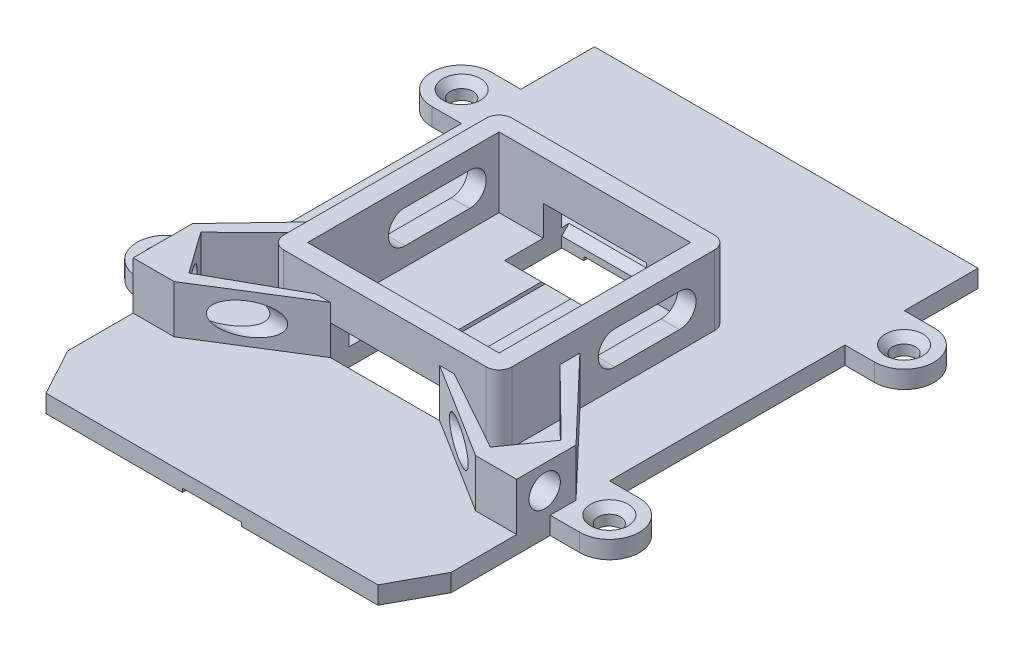
from build123d import *

# Parameters (mm, degrees)
SKETCH1_R              = 1.55
EXTRUDE_707_DEPTH      = 2.4
SKETCH2_W              = 31
SKETCH2_H              = 31
SKETCH2_W_2            = 26
SKETCH2_H_2            = 26
GPS_DEPTH              = 9.5
GPS_2_R                = 1.75
CHAMFER_1832_SIZE      = 1
EXTRUDE_3171_DEPTH     = 6.5
SKETCH4_R              = 2.125
CUT_EXTRUDE_3634_DEPTH = 73.664551053
CUT_EXTRUDE_3926_DEPTH = 65.212061635
SKETCH7_W              = 14
SKETCH7_H              = 6.75
SKETCH7_W_2            = 14.827228548
CUT_EXTRUDE_4854_DEPTH = 6.5
SKETCH8_W              = 4
SKETCH8_H              = 17.5
CUT_EXTRUDE_5206_DEPTH = 0.5
CHAMFER_5287_SIZE      = 1
SKETCH9_W              = 8
SKETCH9_H              = 77.991423638
CUT_EXTRUDE_6206_DEPTH = 0.5


with BuildPart() as part:
    # Sketch1 → Extrude 707 (new body)
    with BuildSketch(Plane(origin=(0, 0, 0), x_dir=(1, 0, 0), z_dir=(0, 1, 0))):
        with BuildLine():
            Line((-26.041067799, 38.995711819), (26.041067799, 38.995711819))
            Line((26.041067799, 38.995711819), (26.041067799, 28.995711819))
            Line((26.041067799, 28.995711819), (30.074330581, 28.995711819))
            ThreePointArc((30.074330581, 28.995711819), (34.107558501, 24.94567978), (30.040792356, 20.929325701))
            Line((30.040792356, 20.929325701), (26.041067799, 20.929325701))
            Line((26.041067799, 20.929325701), (26.041067799, -11.037902063))
            Line((26.041067799, -11.037902063), (30.074330581, -11.037902063))
            ThreePointArc((30.074330581, -11.037902063), (34.107558501, -15.087934101), (30.040792356, -19.104288181))
            Line((30.040792356, -19.104288181), (26.041067799, -19.104288181))
            Line((26.041067799, -19.104288181), (26.041067799, -32.550614881))
            Line((26.041067799, -32.550614881), (22.539090807, -38.995711819))
            Line((22.539090807, -38.995711819), (-22.539090807, -38.995711819))
            Line((-22.539090807, -38.995711819), (-26.041067799, -32.550614881))
            Line((-26.041067799, -32.550614881), (-26.041067799, -19.104288181))
            Line((-26.041067799, -19.104288181), (-30.040792356, -19.104288181))
            ThreePointArc((-30.040792356, -19.104288181), (-34.107558501, -15.087934101), (-30.074330581, -11.037902063))
            Line((-30.074330581, -11.037902063), (-26.041067799, -11.037902063))
            Line((-26.041067799, -11.037902063), (-26.041067799, 20.929325701))
            Line((-26.041067799, 20.929325701), (-30.040792356, 20.929325701))
            ThreePointArc((-30.040792356, 20.929325701), (-34.107558501, 24.94567978), (-30.074330581, 28.995711819))
            Line((-30.074330581, 28.995711819), (-26.041067799, 28.995711819))
            Line((-26.041067799, 28.995711819), (-26.041067799, 38.995711819))
        make_face()
        with Locations(Location((-30.041067799, 24.962449038, 0), (0, 0, 270))):
            Circle(SKETCH1_R, mode=Mode.SUBTRACT)
        with Locations(Location((30.041067799, 24.962449038, 0), (0, 0, 90))):
            Circle(SKETCH1_R, mode=Mode.SUBTRACT)
        with Locations(Location((-30.041067799, -15.071164844, 0), (0, 0, 270))):
            Circle(SKETCH1_R, mode=Mode.SUBTRACT)
        with Locations(Location((30.041067799, -15.071164844, 0), (0, 0, 90))):
            Circle(SKETCH1_R, mode=Mode.SUBTRACT)
    extrude(amount=EXTRUDE_707_DEPTH)

    # Sketch2 → GPS (add)
    with BuildSketch(Plane(origin=(0, 2.4, 0), x_dir=(1, 0, 0), z_dir=(0, 1, 0))):
        Rectangle(SKETCH2_W, SKETCH2_H)
        Rectangle(SKETCH2_W_2, SKETCH2_H_2, mode=Mode.SUBTRACT)
    extrude(amount=GPS_DEPTH)

    # GPS 2
    gps_2_edges = [part.edges().sort_by_distance(p)[0] for p in [
        (15.5, 7.15, -15.5),
        (-15.5, 7.15, -15.5),
        (-15.5, 7.15, 15.5),
        (15.5, 7.15, 15.5),
    ]]
    fillet(gps_2_edges, radius=GPS_2_R)

    # Chamfer 1832
    chamfer_1832_edges = [part.edges().sort_by_distance(p)[0] for p in [
        (-30.041067799, 2.4, -26.512449038),
        (30.041067799, 2.4, -23.412449038),
        (30.041067799, 2.4, 16.621164844),
        (-30.041067799, 2.4, 13.521164844),
    ]]
    chamfer(chamfer_1832_edges, length=CHAMFER_1832_SIZE)

    # Sketch3 → Extrude 3171 (add)
    with BuildSketch(Plane(origin=(0, 2.4, 0), x_dir=(1, 0, 0), z_dir=(0, 1, 0))):
        Polygon((-24.467823985, -16.04483058), (-15.5, -7.229070577), (-15.5, -4.529331749), (-26.041067799, -15.596764458), (-26.041067799, -23.659714375), (-20.467823985, -23.659714375), (-7.413614274, -15.5), (-9.413614274, -15.5), (-20.467823985, -21.659714375), align=None)
        Polygon((9.413614274, -15.5), (7.413614274, -15.5), (20.467823985, -23.659714375), (26.041067799, -23.659714375), (26.041067799, -15.596764458), (15.5, -4.529331749), (15.5, -7.229070577), (24.467823985, -16.04483058), (20.467823985, -21.659714375), align=None)
    extrude(amount=EXTRUDE_3171_DEPTH)

    # Sketch4 → Cut-Extrude 3634 (cut, through all)
    with BuildSketch(Plane.ZY.offset(26.041067799)):
        with Locations((19.852272478, 5.65)):
            Circle(SKETCH4_R)
    extrude(amount=-CUT_EXTRUDE_3634_DEPTH, mode=Mode.SUBTRACT)

    # Sketch6 → Cut-Extrude 3926 (cut, through all)
    with BuildSketch(Plane.ZY.offset(15.5)):
        with BuildLine():
            Line((-9, 9.4), (-0.220668251, 9.4))
            ThreePointArc((-0.220668251, 9.4), (2.029331749, 7.15), (-0.220668251, 4.9))
            Line((-0.220668251, 4.9), (-9, 4.9))
            ThreePointArc((-9, 4.9), (-11.25, 7.15), (-9, 9.4))
        make_face()
    extrude(amount=-CUT_EXTRUDE_3926_DEPTH, mode=Mode.SUBTRACT)

    # Sketch7 → Cut-Extrude 4854 (cut)
    with BuildSketch(Plane(origin=(0, 0, 0), x_dir=(1, 0, 0), z_dir=(0, 1, 0))):
        with Locations((0, 12.125)):
            Rectangle(SKETCH7_W, SKETCH7_H)
        with Locations((0, -12.125)):
            Rectangle(SKETCH7_W_2, SKETCH7_H)
    extrude(amount=CUT_EXTRUDE_4854_DEPTH, mode=Mode.SUBTRACT)

    # Sketch8 → Cut-Extrude 5206 (cut)
    with BuildSketch(Plane(origin=(0, 2.4, 0), x_dir=(1, 0, 0), z_dir=(0, 1, 0))):
        Rectangle(SKETCH8_W, SKETCH8_H)
    extrude(amount=-CUT_EXTRUDE_5206_DEPTH, mode=Mode.SUBTRACT)

    # Chamfer 5287
    chamfer_5287_edges = [part.edges().sort_by_distance(p)[0] for p in [
        (4.5, 2.4, -8.75),
        (0, 2.4, -15.5),
        (-4.706807137, 2.4, 8.75),
    ]]
    chamfer(chamfer_5287_edges, length=CHAMFER_5287_SIZE)

    # Sketch9 → Cut-Extrude 6206 (cut)
    with BuildSketch(Plane.XZ):
        Rectangle(SKETCH9_W, SKETCH9_H)
    extrude(amount=-CUT_EXTRUDE_6206_DEPTH, mode=Mode.SUBTRACT)


solid = part.part
